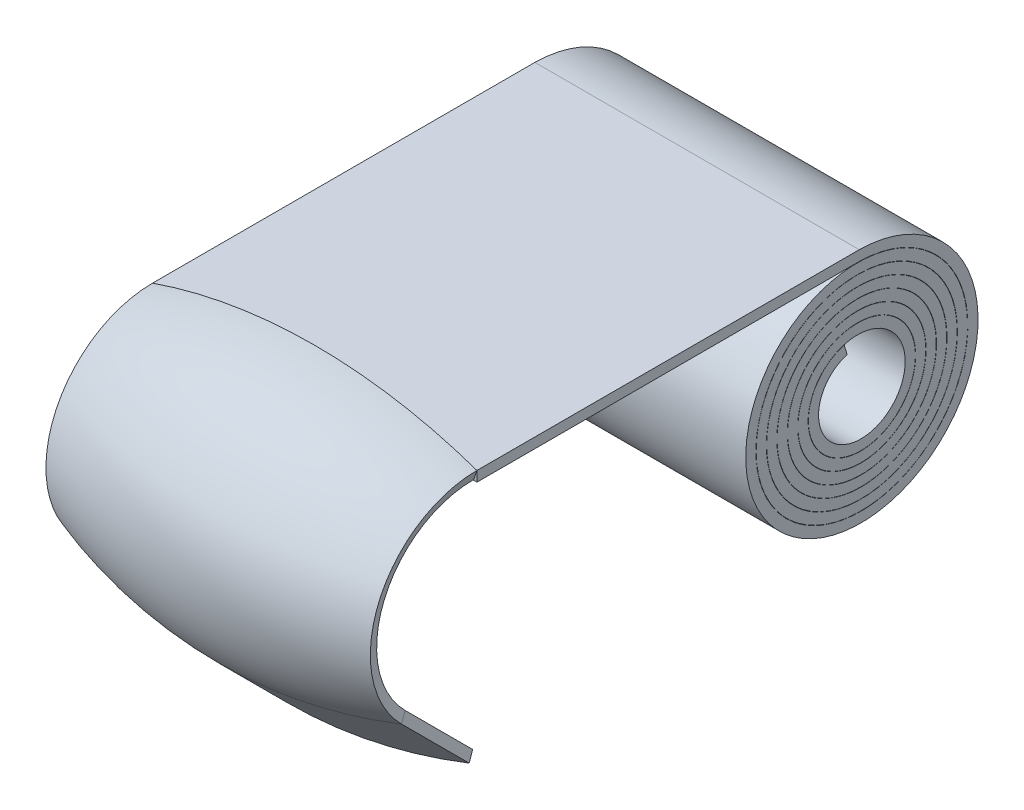
from build123d import *

# Parameters (mm, degrees)
BOSS_EXTRUDE2_DEPTH = 3.75
SKETCH5_W           = 12.727873706
SKETCH5_H           = 0.4
BOSS_EXTRUDE3_DEPTH = 15
SKETCH9_W           = 12.727873706
SKETCH9_H           = 0.4


with BuildPart() as part:
    # Sketch1 → Boss-Extrude2 (new body)
    with BuildSketch(Plane(origin=(0, 0, 0), x_dir=(1, 0, 0), z_dir=(0, 0.7071067811865464, 0.7071067811865488))):
        with BuildLine():
            Line((6.233058974, 1.448570173), (6.363936853, 1.070587394))
            ThreePointArc((6.363936853, 1.070587394), (0, 0), (-6.363936853, 1.070587394))
            Line((-6.363936853, 1.070587394), (-6.233058974, 1.448570173))
            ThreePointArc((-6.233058974, 1.448570173), (0, 0.4), (6.233058974, 1.448570173))
        make_face()
    extrude(amount=BOSS_EXTRUDE2_DEPTH)

    # Sweep1: sweep along a path in Sketch3
    with BuildLine(Plane(origin=(0, 0, 0), x_dir=(0, 0, -1), z_dir=(1, 0, 0))) as sweep1_path:
        ThreePointArc((-2.651650429, 2.651650429), (-3.790474218, 8.376904234), (1.063161595, 11.62))
    # Sketch4 → Sweep1 (sweep)
    with BuildSketch(Plane(origin=(0, 2.651650429, 2.651650429), x_dir=(1, 0, 0), z_dir=(0, 0.7071067811865465, 0.7071067811865487))):
        with BuildLine():
            Line((-6.233058974, 1.448570173), (-6.363936853, 1.070587394))
            ThreePointArc((-6.363936853, 1.070587394), (0, 0), (6.363936853, 1.070587394))
            Line((6.363936853, 1.070587394), (6.233058974, 1.448570173))
            ThreePointArc((6.233058974, 1.448570173), (0, 0.4), (-6.233058974, 1.448570173))
        make_face()
    sweep(path=sweep1_path.line)

    # Sketch5 → Boss-Extrude3 (add)
    with BuildSketch(Plane(origin=(0, 0, -1.063161595), x_dir=(-1, 0, 0), z_dir=(0, 0, -1))):
        with Locations((0, 10.349412606)):
            Rectangle(SKETCH5_W, SKETCH5_H)
    extrude(amount=BOSS_EXTRUDE3_DEPTH)

    # Sweep2: sweep along a curve in space
    with BuildLine() as sweep2_path:
        add(Edge.make_bspline(
            [(0, 10.549412606, -16.063161595), (0, 10.541992033, -16.604748852), (0, 10.441310907, -17.143634673), (0, 10.066612806, -18.154646875), (0, 9.792692485, -18.626550708), (0, 9.104519359, -19.450001016), (0, 8.690431379, -19.80137099), (0, 7.770734218, -20.344481833), (0, 7.265338446, -20.536112112), (0, 6.22188823, -20.73917557), (0, 5.684070785, -20.750576168), (0, 4.637833157, -20.593502666), (0, 4.12964609, -20.425077004), (0, 3.20075845, -19.929328661), (0, 2.780260342, -19.6021291), (0, 2.074236904, -18.827858959), (0, 1.7888604, -18.380971313), (0, 1.384609218, -17.419742787), (0, 1.265813127, -16.905623051), (0, 1.206825656, -15.869588786), (0, 1.266634263, -15.347907816), (0, 1.556330157, -14.356726046), (0, 1.78613959, -13.887444244), (0, 2.387862069, -13.054458749), (0, 2.759629128, -12.690934453), (0, 3.601246554, -12.110214278), (0, 4.070900251, -11.893137954), (0, 5.053440129, -11.628858729), (0, 5.566102068, -11.581702382), (0, 6.575385426, -11.661067369), (0, 7.071781086, -11.78755762), (0, 7.991690107, -12.198037754), (0, 8.415002165, -12.48192326), (0, 9.140839467, -13.173091025), (0, 9.443210768, -13.580208342), (0, 9.893613366, -14.469909168), (0, 10.041555307, -14.952286741), (0, 10.167607739, -15.936395226), (0, 10.145703086, -16.437903297), (0, 9.93622984, -17.402506646), (0, 9.748721309, -17.865387972), (0, 9.23118839, -18.699971428), (0, 8.901291602, -19.071493008), (0, 8.138257866, -19.681601083), (0, 7.705300695, -19.920060848), (0, 6.786872117, -20.237983856), (0, 6.301611456, -20.317388209), (0, 5.334806682, -20.309665478), (0, 4.853479735, -20.222553418), (0, 3.94976134, -19.893463054), (0, 3.527568443, -19.651571196), (0, 2.789992453, -19.042246466), (0, 2.474766658, -18.674960778), (0, 1.986231861, -17.858279964), (0, 1.813021246, -17.409075201), (0, 1.626957976, -16.480956477), (0, 1.614134105, -16.002253716), (0, 1.748677628, -15.070393575), (0, 1.89600163, -14.617443726), (0, 2.332283451, -13.78882071), (0, 2.621131459, -13.413327582), (0, 3.305841524, -12.781921234), (0, 3.701540684, -12.526140153), (0, 4.553420487, -12.162275009), (0, 5.009404447, -12.054260505), (0, 5.928882475, -11.996783052), (0, 6.392169057, -12.047319758), (0, 7.27299692, -12.299477466), (0, 7.690343887, -12.501029016), (0, 8.431873554, -13.030485334), (0, 8.75589731, -13.358260285), (0, 9.274580801, -14.101199012), (0, 9.469134851, -14.516188195), (0, 9.707932583, -15.384990649), (0, 9.752135404, -15.838605123), (0, 9.686774291, -16.732178178), (0, 9.577238302, -17.171936883), (0, 9.218634768, -17.987475033), (0, 8.969659992, -18.363076519), (0, 8.362271801, -19.007889605), (0, 8.004004585, -19.276965381), (0, 7.220346419, -19.6790112), (0, 6.795137682, -19.811902696), (0, 5.927134103, -19.927827894), (0, 5.484536128, -19.910848709), (0, 4.632741914, -19.730641448), (0, 4.223734392, -19.567466881), (0, 3.485685958, -19.115224694), (0, 3.156804006, -18.826270063), (0, 2.615851288, -18.157038891), (0, 2.403891788, -17.77692114), (0, 2.119789306, -16.970014099), (0, 2.047697652, -16.54341061), (0, 2.050016398, -15.693015363), (0, 2.124412987, -15.269414734), (0, 2.409498015, -14.473600993), (0, 2.620109855, -14.101562297), (0, 3.151892036, -13.450972182), (0, 3.47293254, -13.172558606), (0, 4.187455927, -12.740084111), (0, 4.5807713, -12.586109045), (0, 5.393871618, -12.418731997), (0, 5.813471093, -12.405354626), (0, 6.630684954, -12.519061821), (0, 7.028117452, -12.646107662), (0, 7.755656127, -13.024429197), (0, 8.085604874, -13.275608049), (0, 8.641117894, -13.871903405), (0, 8.866567001, -14.216876792), (0, 9.188460317, -14.960060478), (0, 9.284844352, -15.358098409), (0, 9.339099063, -16.1611049), (0, 9.2969708, -16.565892027), (0, 9.080708854, -17.335873028), (0, 8.906636587, -17.700897381), (0, 8.448063436, -18.349957379), (0, 8.16367651, -18.633854762), (0, 7.518452179, -19.0890836), (0, 7.157767508, -19.26032356), (0, 6.402267906, -19.471980992), (0, 6.007626429, -19.512363672), (0, 5.229908877, -19.459297814), (0, 4.847006765, -19.365874468), (0, 4.136547731, -19.05758586), (0, 3.809145266, -18.84280211), (0, 3.246546121, -18.317958602), (0, 3.01146688, -18.008026575), (0, 2.65931204, -17.329645159), (0, 2.542303831, -16.961354433), (0, 2.438207863, -16.209247028), (0, 2.451130348, -15.825601292), (0, 2.603745418, -15.086988691), (0, 2.743390672, -14.732185227), (0, 3.131794975, -14.091582606), (0, 3.380455319, -13.805920614), (0, 3.956948524, -13.335467468), (0, 4.284643342, -13.150771814), (0, 4.980582599, -12.902112696), (0, 5.34866606, -12.838192637), (0, 6.082630928, -12.83682198), (0, 6.448347248, -12.899358401), (0, 7.135663285, -13.142046971), (0, 7.457112853, -13.32213201), (0, 8.019620142, -13.777689545), (0, 8.26055972, -14.05304926), (0, 8.635499384, -14.666290387), (0, 8.769426483, -15.004026947), (0, 8.916435009, -15.702440513), (0, 8.929496377, -16.062957703), (0, 8.834929167, -16.765275234), (0, 8.727335028, -17.106919388), (0, 8.405458739, -17.732570772), (0, 8.191260801, -18.016443359), (0, 7.68222088, -18.494799668), (0, 7.387502494, -18.689185477), (0, 6.752344914, -18.967528641), (0, 6.412053921, -19.051435557), (0, 5.725415368, -19.100756015), (0, 5.379223212, -19.066171717), (0, 4.720563814, -18.884157926), (0, 4.408241195, -18.736782185), (0, 3.852649271, -18.347698236), (0, 3.609497324, -18.106088437), (0, 3.219130233, -17.557598697), (0, 3.071992079, -17.250849847), (0, 2.889128688, -16.608200279), (0, 2.853431808, -16.27244777), (0, 2.895912361, -15.610712031), (0, 2.974066976, -15.284876822), (0, 3.233609903, -14.680187791), (0, 3.414927612, -14.401464772), (0, 3.858474274, -13.922255472), (0, 4.120593683, -13.72186798), (0, 4.694481079, -13.421129618), (0, 5.006113778, -13.320834641), (0, 5.642552503, -13.230267326), (0, 5.967213458, -13.24000221), (0, 6.592290508, -13.366702738), (0, 6.892568597, -13.48362685), (0, 7.434830799, -13.809655948), (0, 7.676699742, -14.018676184), (0, 8.075321065, -14.503510698), (0, 8.231994009, -14.779207438), (0, 8.443593288, -15.364750501), (0, 8.498484503, -15.674460542), (0, 8.501830015, -16.291993116), (0, 8.450296846, -16.599676608), (0, 8.248389551, -17.177919746), (0, 8.098073408, -17.448353641), (0, 7.717410701, -17.921695872), (0, 7.487160161, -18.124506007), (0, 6.974309976, -18.4404462), (0, 6.691832725, -18.553516464), (0, 6.10775573, -18.678478085), (0, 5.806290228, -18.690354309), (0, 5.219100303, -18.613228235), (0, 4.933506319, -18.524256472), (0, 4.410528327, -18.257301748), (0, 4.173255997, -18.079390712), (0, 3.773306793, -17.656433174), (0, 3.610710296, -17.411491012), (0, 3.377487978, -16.883672195), (0, 3.306902506, -16.60091973), (0, 3.264226416, -16.030526632), (0, 3.292132155, -15.743015401), (0, 3.441550394, -15.196134083), (0, 3.563016438, -14.936883617), (0, 3.884015974, -14.475742632), (0, 4.083466289, -14.273948347), (0, 4.536216642, -13.949839071), (0, 4.789407005, -13.827586252), (0, 5.319677555, -13.675165404), (0, 5.59663467, -13.645018925), (0, 6.142281188, -13.678625272), (0, 6.410848537, -13.742357267), (0, 6.909094103, -13.954731165), (0, 7.138665329, -14.103313018), (0, 7.533322832, -14.466823476), (0, 7.69832923, -14.681660442), (0, 7.946134477, -15.151853283), (0, 8.028889268, -15.407097067), (0, 8.104231259, -15.928113339), (0, 8.09681464, -16.193766574), (0, 7.994347337, -16.704972713), (0, 7.899332761, -16.95041308), (0, 7.634206517, -17.393456537), (0, 7.464165972, -17.590966648), (0, 7.069896313, -17.916436005), (0, 6.845764475, -18.044332175), (0, 6.370028245, -18.217261679), (0, 6.118535571, -18.26226854), (0, 5.617418269, -18.265874574), (0, 5.367906644, -18.22448622), (0, 4.89929368, -18.061738889), (0, 4.680293572, -17.940429134), (0, 4.297183795, -17.633319669), (0, 4.133152145, -17.447599529), (0, 3.877666018, -17.034232916), (0, 3.786257815, -16.806686583), (0, 3.685017386, -16.336577491), (0, 3.67519499, -16.094123481), (0, 3.736581098, -15.622273649), (0, 3.807762592, -15.392982466), (0, 4.021327905, -14.973447031), (0, 4.163651745, -14.78329132), (0, 4.501713601, -14.46298649), (0, 4.697366271, -14.332899934), (0, 5.118550921, -14.146361352), (0, 5.343982565, -14.089939235), (0, 5.79827156, -14.055616044), (0, 6.027025481, -14.077709463), (0, 6.461690556, -14.196189576), (0, 6.66750719, -14.292536737), (0, 7.033230015, -14.546867316), (0, 7.193061315, -14.704782471), (0, 7.449527885, -15.062803924), (0, 7.54611611, -15.262821739), (0, 7.606283721, -15.472012085)],
            knots=[0, 0, 0, 0, 0.0078125, 0.0078125, 0.015625, 0.015625, 0.0234375, 0.0234375, 0.03125, 0.03125, 0.0390625, 0.0390625, 0.046875, 0.046875, 0.0546875, 0.0546875, 0.0625, 0.0625, 0.0703125, 0.0703125, 0.078125, 0.078125, 0.0859375, 0.0859375, 0.09375, 0.09375, 0.1015625, 0.1015625, 0.109375, 0.109375, 0.1171875, 0.1171875, 0.125, 0.125, 0.1328125, 0.1328125, 0.140625, 0.140625, 0.1484375, 0.1484375, 0.15625, 0.15625, 0.1640625, 0.1640625, 0.171875, 0.171875, 0.1796875, 0.1796875, 0.1875, 0.1875, 0.1953125, 0.1953125, 0.203125, 0.203125, 0.2109375, 0.2109375, 0.21875, 0.21875, 0.2265625, 0.2265625, 0.234375, 0.234375, 0.2421875, 0.2421875, 0.25, 0.25, 0.2578125, 0.2578125, 0.265625, 0.265625, 0.2734375, 0.2734375, 0.28125, 0.28125, 0.2890625, 0.2890625, 0.296875, 0.296875, 0.3046875, 0.3046875, 0.3125, 0.3125, 0.3203125, 0.3203125, 0.328125, 0.328125, 0.3359375, 0.3359375, 0.34375, 0.34375, 0.3515625, 0.3515625, 0.359375, 0.359375, 0.3671875, 0.3671875, 0.375, 0.375, 0.3828125, 0.3828125, 0.390625, 0.390625, 0.3984375, 0.3984375, 0.40625, 0.40625, 0.4140625, 0.4140625, 0.421875, 0.421875, 0.4296875, 0.4296875, 0.4375, 0.4375, 0.4453125, 0.4453125, 0.453125, 0.453125, 0.4609375, 0.4609375, 0.46875, 0.46875, 0.4765625, 0.4765625, 0.484375, 0.484375, 0.4921875, 0.4921875, 0.5, 0.5, 0.5078125, 0.5078125, 0.515625, 0.515625, 0.5234375, 0.5234375, 0.53125, 0.53125, 0.5390625, 0.5390625, 0.546875, 0.546875, 0.5546875, 0.5546875, 0.5625, 0.5625, 0.5703125, 0.5703125, 0.578125, 0.578125, 0.5859375, 0.5859375, 0.59375, 0.59375, 0.6015625, 0.6015625, 0.609375, 0.609375, 0.6171875, 0.6171875, 0.625, 0.625, 0.6328125, 0.6328125, 0.640625, 0.640625, 0.6484375, 0.6484375, 0.65625, 0.65625, 0.6640625, 0.6640625, 0.671875, 0.671875, 0.6796875, 0.6796875, 0.6875, 0.6875, 0.6953125, 0.6953125, 0.703125, 0.703125, 0.7109375, 0.7109375, 0.71875, 0.71875, 0.7265625, 0.7265625, 0.734375, 0.734375, 0.7421875, 0.7421875, 0.75, 0.75, 0.7578125, 0.7578125, 0.765625, 0.765625, 0.7734375, 0.7734375, 0.78125, 0.78125, 0.7890625, 0.7890625, 0.796875, 0.796875, 0.8046875, 0.8046875, 0.8125, 0.8125, 0.8203125, 0.8203125, 0.828125, 0.828125, 0.8359375, 0.8359375, 0.84375, 0.84375, 0.8515625, 0.8515625, 0.859375, 0.859375, 0.8671875, 0.8671875, 0.875, 0.875, 0.8828125, 0.8828125, 0.890625, 0.890625, 0.8984375, 0.8984375, 0.90625, 0.90625, 0.9140625, 0.9140625, 0.921875, 0.921875, 0.9296875, 0.9296875, 0.9375, 0.9375, 0.9453125, 0.9453125, 0.953125, 0.953125, 0.9609375, 0.9609375, 0.96875, 0.96875, 0.9765625, 0.9765625, 0.984375, 0.984375, 0.9921875, 0.9921875, 1, 1, 1, 1], degree=3))
    # Sketch9 → Sweep2 (sweep)
    with BuildSketch(Plane(origin=(0, 0, -16.063161595), x_dir=(-1, 0, 0), z_dir=(0, 0, -1))):
        with Locations((0, 10.349412606)):
            Rectangle(SKETCH9_W, SKETCH9_H)
    sweep(path=sweep2_path.line, is_frenet=True)


solid = part.part
